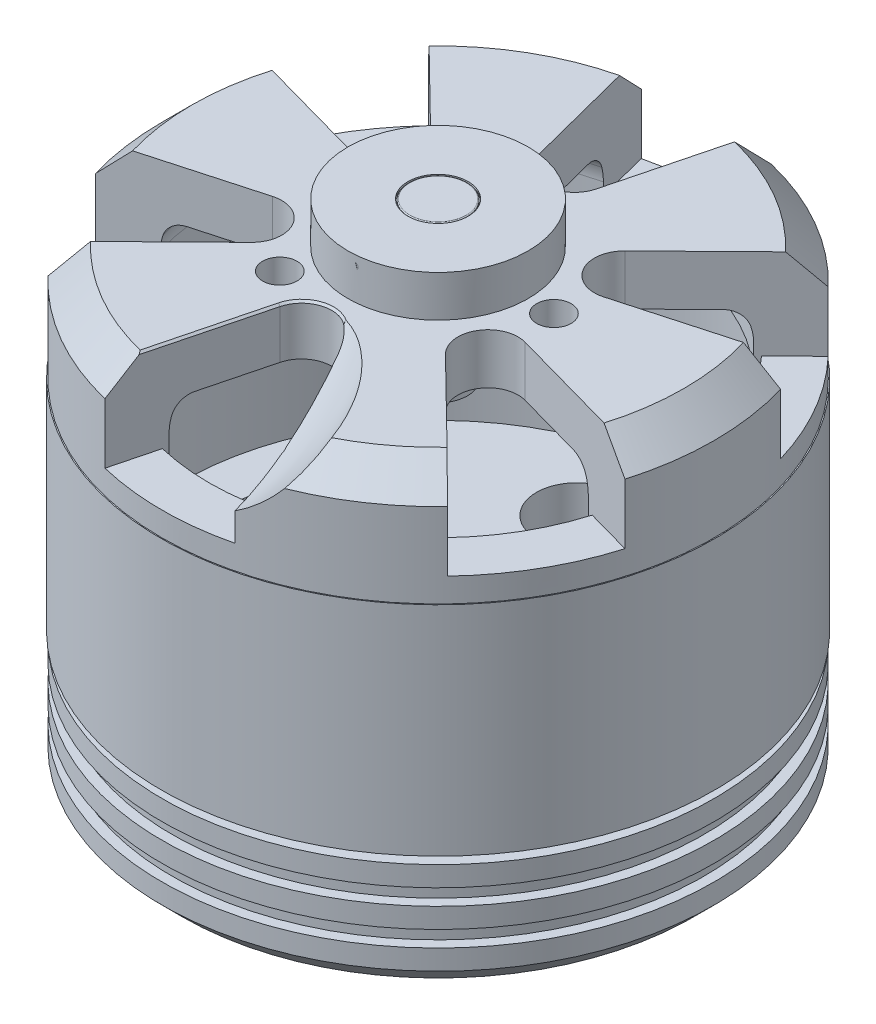
from build123d import *

# Parameters (mm, degrees)
SKETCH2_R           = 13.8
SKETCH2_R_2         = 12.8
STEEL_DEPTH         = 10.85
SKETCH3_R           = 13.75
BOSS_EXTRUDE2_DEPTH = 5.7
SKETCH5_R           = 4.49
BOSS_EXTRUDE3_DEPTH = 2.06
CHAMFER1_SIZE       = 1.5
CUT_EXTRUDE1_DEPTH  = 4.5
CUT_EXTRUDE2_DEPTH  = 4.5
CHAMFER7_SIZE       = 0.1
CUT_REVOLVE2_ANGLE  = 74
SKETCH11_R          = 0.858628619
CUT_EXTRUDE4_DEPTH  = 13.5
SKETCH12_R          = 1.5
CUT_EXTRUDE5_DEPTH  = 0.1
SKETCH13_R          = 1.45
BOSS_EXTRUDE4_DEPTH = 0.1
FILLET1_R           = 0.05
CUT_EXTRUDE6_DEPTH  = 10
SKETCH15_R          = 1.2
CUT_EXTRUDE7_DEPTH  = 5
SKETCH16_R          = 2.8
BOSS_EXTRUDE5_DEPTH = 1.3
SKETCH17_R          = 1.475
BOSS_EXTRUDE6_DEPTH = 0.95
FILLET2_R           = 0.1


with BuildPart() as part:
    # Sketch1 → Revolve1 (revolve)
    with BuildSketch(Plane(origin=(0, 0, 0), x_dir=(0, 0, -1), z_dir=(1, 0, 0))):
        Polygon((0, 0), (12.75, 0), (13.75, 1), (13.75, 2), (13.25, 2), (13.25, 2.8), (13.75, 2.8), (13.75, 3.8), (13.25, 3.8), (13.25, 4.6), (13.75, 4.6), (13.75, 5.6), (0, 5.6), align=None)
    revolve(axis=Axis((0, 0, 0), (0, 1, 0)))

    # Sketch14 → Cut-Extrude6 (cut)
    with BuildSketch(Plane.XZ):
        with BuildLine():
            ThreePointArc((2.315900865, 10.753446107), (0, 11), (-2.315900865, 10.753446107))
            ThreePointArc((-2.315900865, 10.753446107), (-3.85, 8.377201203), (-1.473755096, 6.843102068))
            ThreePointArc((-1.473755096, 6.843102068), (0, 7), (1.473755096, 6.843102068))
            ThreePointArc((1.473755096, 6.843102068), (3.85, 8.377201203), (2.315900865, 10.753446107))
        make_face()
        with BuildLine():
            ThreePointArc((10.753446107, -2.315900865), (11, 0), (10.753446107, 2.315900865))
            ThreePointArc((10.753446107, 2.315900865), (8.377201203, 3.85), (6.843102068, 1.473755096))
            ThreePointArc((6.843102068, 1.473755096), (7, 0), (6.843102068, -1.473755096))
            ThreePointArc((6.843102068, -1.473755096), (8.377201203, -3.85), (10.753446107, -2.315900865))
        make_face()
        with BuildLine():
            ThreePointArc((-2.315900865, -10.753446107), (0, -11), (2.315900865, -10.753446107))
            ThreePointArc((2.315900865, -10.753446107), (3.85, -8.377201203), (1.473755096, -6.843102068))
            ThreePointArc((1.473755096, -6.843102068), (0, -7), (-1.473755096, -6.843102068))
            ThreePointArc((-1.473755096, -6.843102068), (-3.85, -8.377201203), (-2.315900865, -10.753446107))
        make_face()
        with BuildLine():
            ThreePointArc((-10.753446107, 2.315900865), (-11, 0), (-10.753446107, -2.315900865))
            ThreePointArc((-10.753446107, -2.315900865), (-8.377201203, -3.85), (-6.843102068, -1.473755096))
            ThreePointArc((-6.843102068, -1.473755096), (-7, 0), (-6.843102068, 1.473755096))
            ThreePointArc((-6.843102068, 1.473755096), (-8.377201203, 3.85), (-10.753446107, 2.315900865))
        make_face()
    extrude(amount=-CUT_EXTRUDE6_DEPTH, mode=Mode.SUBTRACT)

    # Sketch15 → Cut-Extrude7 (cut)
    with BuildSketch(Plane.XZ):
        with Locations(Location((6.717514421, 6.717514421, 0), (0, 0, 270))):
            Circle(SKETCH15_R)
        with Locations(Location((-6.717514421, -6.717514421, 0), (0, 0, 90))):
            Circle(SKETCH15_R)
        with Locations(Location((-5.656854249, 5.656854249, 0), (0, 0, 270))):
            Circle(SKETCH15_R)
        with Locations(Location((5.656854249, -5.656854249, 0), (0, 0, 90))):
            Circle(SKETCH15_R)
    extrude(amount=-CUT_EXTRUDE7_DEPTH, mode=Mode.SUBTRACT)


with BuildPart() as body_2:
    # Sketch2 → Steel (new body)
    with BuildSketch(Plane.XZ.offset(-6)):
        with Locations(Location((0, 0, 0), (0, 0, 270))):
            Circle(SKETCH2_R)
        with Locations(Location((0, 0, 0), (0, 0, 270))):
            Circle(SKETCH2_R_2, mode=Mode.SUBTRACT)
    extrude(amount=-STEEL_DEPTH)


with BuildPart() as body_3:
    # Sketch3 → Boss-Extrude2 (new body)
    with BuildSketch(Plane(origin=(0, 16.85, 0), x_dir=(1, 0, 0), z_dir=(0, 1, 0))):
        with Locations(Location((0, 0, 0), (0, 0, 90))):
            Circle(SKETCH3_R)
    extrude(amount=BOSS_EXTRUDE2_DEPTH)

    # Sketch5 → Boss-Extrude3 (add)
    with BuildSketch(Plane(origin=(0, 22.55, 0), x_dir=(1, 0, 0), z_dir=(0, 1, 0))):
        with Locations(Location((0, 0, 0), (0, 0, 90))):
            Circle(SKETCH5_R)
    extrude(amount=BOSS_EXTRUDE3_DEPTH)

    # Chamfer1
    chamfer1_edges = [body_3.edges().sort_by_distance(p)[0] for p in [
        (0, 22.55, 13.75),
    ]]
    chamfer(chamfer1_edges, length=CHAMFER1_SIZE)

    # Sketch6 → Cut-Extrude1 (cut)
    with BuildSketch(Plane(origin=(0, 22.55, 0), x_dir=(1, 0, 0), z_dir=(0, 1, 0))):
        with BuildLine():
            Line((3.25, 13.411841783), (1.452688524, 6.426240648))
            ThreePointArc((1.452688524, 6.426240648), (0, 5.3), (-1.452688524, 6.426240648))
            Line((-1.452688524, 6.426240648), (-3.25, 13.411841783))
            ThreePointArc((-3.25, 13.411841783), (0, 13.8), (3.25, 13.411841783))
        make_face()
        with BuildLine():
            Line((13.239995695, 3.891338329), (6.291631914, 1.955055159))
            ThreePointArc((6.291631914, 1.955055159), (4.58993464, 2.65), (4.83894339, 4.471185489))
            Line((4.83894339, 4.471185489), (9.989995695, 9.520503454))
            ThreePointArc((9.989995695, 9.520503454), (11.951150572, 6.9), (13.239995695, 3.891338329))
        make_face()
        with BuildLine():
            Line((9.989995695, -9.520503454), (4.83894339, -4.471185489))
            ThreePointArc((4.83894339, -4.471185489), (4.58993464, -2.65), (6.291631914, -1.955055159))
            Line((6.291631914, -1.955055159), (13.239995695, -3.891338329))
            ThreePointArc((13.239995695, -3.891338329), (11.951150572, -6.9), (9.989995695, -9.520503454))
        make_face()
        with BuildLine():
            Line((-3.25, -13.411841783), (-1.452688524, -6.426240648))
            ThreePointArc((-1.452688524, -6.426240648), (0, -5.3), (1.452688524, -6.426240648))
            Line((1.452688524, -6.426240648), (3.25, -13.411841783))
            ThreePointArc((3.25, -13.411841783), (0, -13.8), (-3.25, -13.411841783))
        make_face()
        with BuildLine():
            Line((-13.239995695, -3.891338329), (-6.291631914, -1.955055159))
            ThreePointArc((-6.291631914, -1.955055159), (-4.58993464, -2.65), (-4.83894339, -4.471185489))
            Line((-4.83894339, -4.471185489), (-9.989995695, -9.520503454))
            ThreePointArc((-9.989995695, -9.520503454), (-11.951150572, -6.9), (-13.239995695, -3.891338329))
        make_face()
        with BuildLine():
            Line((-9.989995695, 9.520503454), (-4.83894339, 4.471185489))
            ThreePointArc((-4.83894339, 4.471185489), (-4.58993464, 2.65), (-6.291631914, 1.955055159))
            Line((-6.291631914, 1.955055159), (-13.239995695, 3.891338329))
            ThreePointArc((-13.239995695, 3.891338329), (-11.951150572, 6.9), (-9.989995695, 9.520503454))
        make_face()
    extrude(amount=-CUT_EXTRUDE1_DEPTH, mode=Mode.SUBTRACT)

    # Sketch7 → Cut-Extrude2 (cut)
    with BuildSketch(Plane(origin=(0, 18.05, 0), x_dir=(1, 0, 0), z_dir=(0, 1, 0))):
        with BuildLine():
            Line((8.275893071, 7.840254708), (4.83894339, 4.471185489))
            ThreePointArc((4.83894339, 4.471185489), (4.58993464, 2.65), (6.291631914, 1.955055159))
            Line((6.291631914, 1.955055159), (10.927806284, 3.247006284))
            ThreePointArc((10.927806284, 3.247006284), (9.872689603, 5.7), (8.275893071, 7.840254708))
        make_face()
        with BuildLine():
            Line((-2.651913214, 11.087260992), (-1.452688524, 6.426240648))
            ThreePointArc((-1.452688524, 6.426240648), (0, 5.3), (1.452688524, 6.426240648))
            Line((1.452688524, 6.426240648), (2.651913214, 11.087260992))
            ThreePointArc((2.651913214, 11.087260992), (0, 11.4), (-2.651913214, 11.087260992))
        make_face()
        with BuildLine():
            Line((10.927806284, -3.247006284), (6.291631914, -1.955055159))
            ThreePointArc((6.291631914, -1.955055159), (4.58993464, -2.65), (4.83894339, -4.471185489))
            Line((4.83894339, -4.471185489), (8.275893071, -7.840254708))
            ThreePointArc((8.275893071, -7.840254708), (9.872689603, -5.7), (10.927806284, -3.247006284))
        make_face()
        with BuildLine():
            Line((2.651913214, -11.087260992), (1.452688524, -6.426240648))
            ThreePointArc((1.452688524, -6.426240648), (0, -5.3), (-1.452688524, -6.426240648))
            Line((-1.452688524, -6.426240648), (-2.651913214, -11.087260992))
            ThreePointArc((-2.651913214, -11.087260992), (0, -11.4), (2.651913214, -11.087260992))
        make_face()
        with BuildLine():
            Line((-8.275893071, -7.840254708), (-4.83894339, -4.471185489))
            ThreePointArc((-4.83894339, -4.471185489), (-4.58993464, -2.65), (-6.291631914, -1.955055159))
            Line((-6.291631914, -1.955055159), (-10.927806284, -3.247006284))
            ThreePointArc((-10.927806284, -3.247006284), (-9.872689603, -5.7), (-8.275893071, -7.840254708))
        make_face()
        with BuildLine():
            Line((-10.927806284, 3.247006284), (-6.291631914, 1.955055159))
            ThreePointArc((-6.291631914, 1.955055159), (-4.58993464, 2.65), (-4.83894339, 4.471185489))
            Line((-4.83894339, 4.471185489), (-8.275893071, 7.840254708))
            ThreePointArc((-8.275893071, 7.840254708), (-9.872689603, 5.7), (-10.927806284, 3.247006284))
        make_face()
    extrude(amount=-CUT_EXTRUDE2_DEPTH, mode=Mode.SUBTRACT)

    # Sketch8 → Cut-Revolve1 (revolve, cut)
    with BuildSketch(Plane(origin=(0, 0, 0), x_dir=(0, 0, -1), z_dir=(1, 0, 0)), mode=Mode.PRIVATE) as cut_revolve1_sk:
        with BuildLine():
            Line((11.125094862, 16.85), (11.125094862, 18.644026038))
            ThreePointArc((11.125094862, 18.644026038), (11.098943951, 18.99373856), (11.021072888, 19.335672494))
            ThreePointArc((11.021072888, 19.335672494), (10.659389448, 19.845937802), (10.065311126, 20.0415306))
            Line((10.065311126, 20.0415306), (1.473040891, 20.0415306))
            Line((1.473040891, 20.0415306), (1.473040891, 16.85))
            Line((1.473040891, 16.85), (11.125094862, 16.85))
        make_face()
    revolve(cut_revolve1_sk.sketch.rotate(Axis((0, 0, 0), (0, 1, 0)), 13.61859017), axis=Axis((0, 0, 0), (0, 1, 0)), mode=Mode.SUBTRACT)

    # Chamfer7
    chamfer7_edges = [body_3.edges().sort_by_distance(p)[0] for p in [
        (-2.15821368, 22.55, 9.168401591),
        (0, 22.55, 5.3),
        (2.15821368, 22.55, 9.168401591),
    ]]
    chamfer(chamfer7_edges, length=CHAMFER7_SIZE)

    # Sketch10 → Cut-Revolve2 (revolve, cut)
    with BuildSketch(Plane(origin=(0, 25.55, 0), x_dir=(1, 0, 0), z_dir=(0, 1, 0))):
        with BuildLine():
            Line((0, -14.858255789), (3.085569072, -19.418392038))
            Line((3.085569072, -19.418392038), (6.957044516, -13.75))
            ThreePointArc((6.957044516, -13.75), (5.538406956, -8.911857316), (2.525339163, -4.869385346))
            ThreePointArc((2.525339163, -4.869385346), (0.903346308, -4.587999305), (0, -5.964227619))
            Line((0, -5.964227619), (0, -14.858255789))
        make_face()
    revolve(axis=Axis((0, 25.55, 0), (0, 0, -1)), revolution_arc=CUT_REVOLVE2_ANGLE, mode=Mode.SUBTRACT)

    # Sketch11 → Cut-Extrude4 (cut)
    with BuildSketch(Plane(origin=(0, 22.55, 0), x_dir=(1, 0, 0), z_dir=(0, 1, 0))):
        with Locations(Location((-2.886751346, 5, 0), (0, 0, 270))):
            Circle(SKETCH11_R)
        with Locations(Location((5.773502692, 0, 0), (0, 0, 270))):
            Circle(SKETCH11_R)
        with Locations(Location((-2.886751346, -5, 0), (0, 0, 270))):
            Circle(SKETCH11_R)
    extrude(amount=-CUT_EXTRUDE4_DEPTH, mode=Mode.SUBTRACT)

    # Sketch12 → Cut-Extrude5 (cut)
    with BuildSketch(Plane(origin=(0, 24.61, 0), x_dir=(1, 0, 0), z_dir=(0, 1, 0))):
        with Locations(Location((0, 0, 0), (0, 0, 270))):
            Circle(SKETCH12_R)
    extrude(amount=-CUT_EXTRUDE5_DEPTH, mode=Mode.SUBTRACT)


with BuildPart() as body_4:
    # Sketch13 → Boss-Extrude4 (new body)
    with BuildSketch(Plane(origin=(0, 24.51, 0), x_dir=(1, 0, 0), z_dir=(0, 1, 0))):
        with Locations(Location((0, 0, 0), (0, 0, 270))):
            Circle(SKETCH13_R)
    extrude(amount=BOSS_EXTRUDE4_DEPTH)

    # Fillet1
    fillet1_edges = [body_4.edges().sort_by_distance(p)[0] for p in [
        (0, 24.61, -1.45),
    ]]
    fillet(fillet1_edges, radius=FILLET1_R)


with BuildPart() as body_5:
    # Sketch16 → Boss-Extrude5 (new body)
    with BuildSketch(Plane.XZ):
        with Locations(Location((0, 0, 0), (0, 0, 270))):
            Circle(SKETCH16_R)
    extrude(amount=BOSS_EXTRUDE5_DEPTH)


with BuildPart() as body_6:
    # Sketch17 → Boss-Extrude6 (new body)
    with BuildSketch(Plane.XZ.offset(1.3)):
        with Locations(Location((0, 0, 0), (0, 0, 90))):
            Circle(SKETCH17_R)
    extrude(amount=BOSS_EXTRUDE6_DEPTH)

    # Fillet2
    fillet2_edges = [body_6.edges().sort_by_distance(p)[0] for p in [
        (0, -2.25, -1.475),
    ]]
    fillet(fillet2_edges, radius=FILLET2_R)


solid = Compound([part.part, body_2.part, body_3.part, body_4.part, body_5.part, body_6.part])
